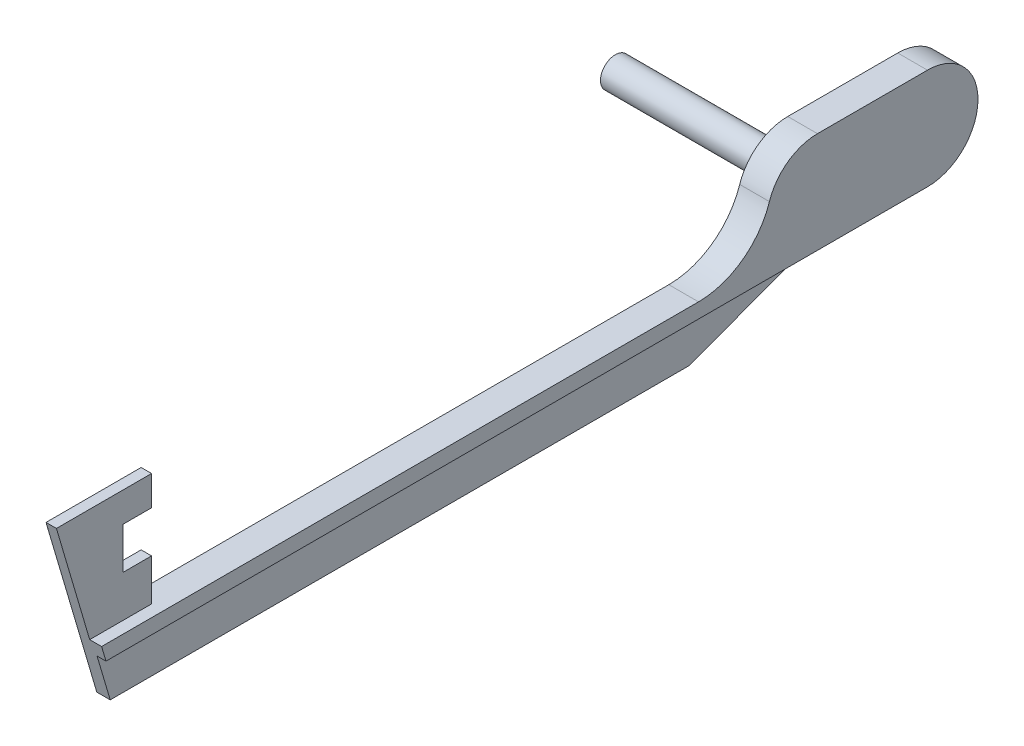
from build123d import *

# Parameters (mm, degrees)
BOSS_EXTRUDE2_DEPTH = 2.54
BOSS_EXTRUDE3_DEPTH = 1.778
BOSS_EXTRUDE4_START = 1.524
BOSS_EXTRUDE4_DEPTH = 1.27
SKETCH2_W           = 0.634140794
SKETCH2_H           = 8.731528753
CUT_EXTRUDE1_DEPTH  = 75.912777682
SKETCH1_8_R         = 1.27
BOSS_EXTRUDE5_DEPTH = 14.986


with BuildPart() as part:
    # Sketch1 → Boss-Extrude2 (new body)
    with BuildSketch(Plane(origin=(0, 0, 0), x_dir=(0, 0, -1), z_dir=(1, 0, 0))):
        with BuildLine():
            Line((0, 4.318), (-9.398, 4.318))
            ThreePointArc((-9.398, 4.318), (-11.932525974, 3.495897895), (-13.501957395, 1.342630889))
            ThreePointArc((-13.501957395, 1.342630889), (-15.817903355, -1.834857441), (-19.558, -3.048))
            Line((-19.558, -3.048), (-70.56158602, -3.048))
            Line((-70.56158602, -3.048), (-70.187321023, -4.318))
            Line((-70.187321023, -4.318), (0, -4.318))
            ThreePointArc((0, -4.318), (4.318, 0), (0, 4.318))
        make_face()
    extrude(amount=BOSS_EXTRUDE2_DEPTH)

    # Sketch1<5> → Boss-Extrude3 (add)
    with BuildSketch(Plane(origin=(0, 0, 0), x_dir=(0, 0, -1), z_dir=(1, 0, 0))):
        Polygon((-19.558, -8.128), (-9.398, -4.318), (-70.187321023, -4.318), (-69.06452603, -8.128), align=None)
    extrude(amount=BOSS_EXTRUDE3_DEPTH)

    # Sketch1<7> → Boss-Extrude4 (add)
    with BuildSketch(Plane(origin=(0, 0, 0), x_dir=(0, 0, -1), z_dir=(1, 0, 0)).offset(BOSS_EXTRUDE4_START)):
        Polygon((-70.56158602, -3.048), (-65.278, -3.048), (-65.278, 0.508), (-67.708502007, 0.508), (-67.708502007, 4.064), (-65.278, 4.064), (-65.278, 6.604), (-73.406, 6.604), align=None)
    extrude(amount=-BOSS_EXTRUDE4_DEPTH)

    # Sketch2 → Cut-Extrude1 (cut, through all)
    with BuildSketch(Plane(origin=(0, 6.604, 0), x_dir=(1, 0, 0), z_dir=(0, 1, 0))):
        with Locations((0.317070397, -69.040235623)):
            Rectangle(SKETCH2_W, SKETCH2_H)
    extrude(amount=-CUT_EXTRUDE1_DEPTH, mode=Mode.SUBTRACT)

    # Sketch1<8> → Boss-Extrude5 (add)
    with BuildSketch(Plane(origin=(0, 0, 0), x_dir=(0, 0, -1), z_dir=(1, 0, 0))):
        with Locations((-9.144, 0)):
            Circle(SKETCH1_8_R)
    extrude(amount=-BOSS_EXTRUDE5_DEPTH)


solid = part.part
